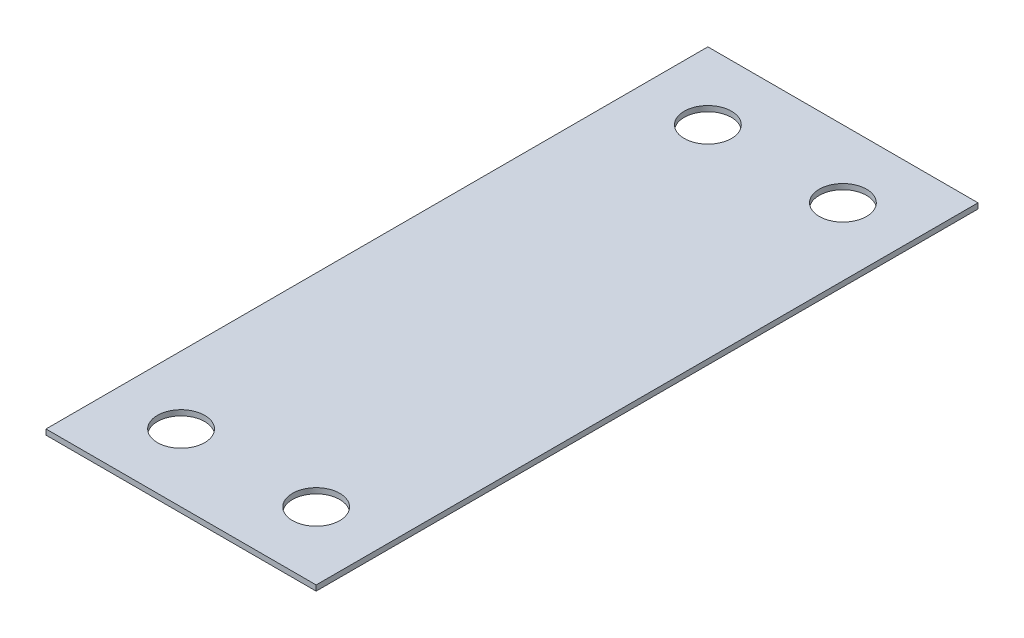
from build123d import *

# Parameters (mm, degrees)
SKETCH1_R           = 1.75
BOSS_EXTRUDE1_DEPTH = 0.4


with BuildPart() as part:
    # Sketch1 → Boss-Extrude1 (new body)
    with BuildSketch(Plane(origin=(0, 0, 0), x_dir=(1, 0, 0), z_dir=(0, 1, 0))):
        Polygon((0, 0), (20, 0), (20, 10), (20, 35), (20, 49), (0, 49), align=None)
        with Locations(Location((5, 44, 0), (0, 0, 270))):
            Circle(SKETCH1_R, mode=Mode.SUBTRACT)
        with Locations(Location((15, 44, 0), (0, 0, 270))):
            Circle(SKETCH1_R, mode=Mode.SUBTRACT)
        with Locations(Location((15, 5, 0), (0, 0, 270))):
            Circle(SKETCH1_R, mode=Mode.SUBTRACT)
        with Locations(Location((5, 5, 0), (0, 0, 270))):
            Circle(SKETCH1_R, mode=Mode.SUBTRACT)
    extrude(amount=BOSS_EXTRUDE1_DEPTH)


solid = part.part
